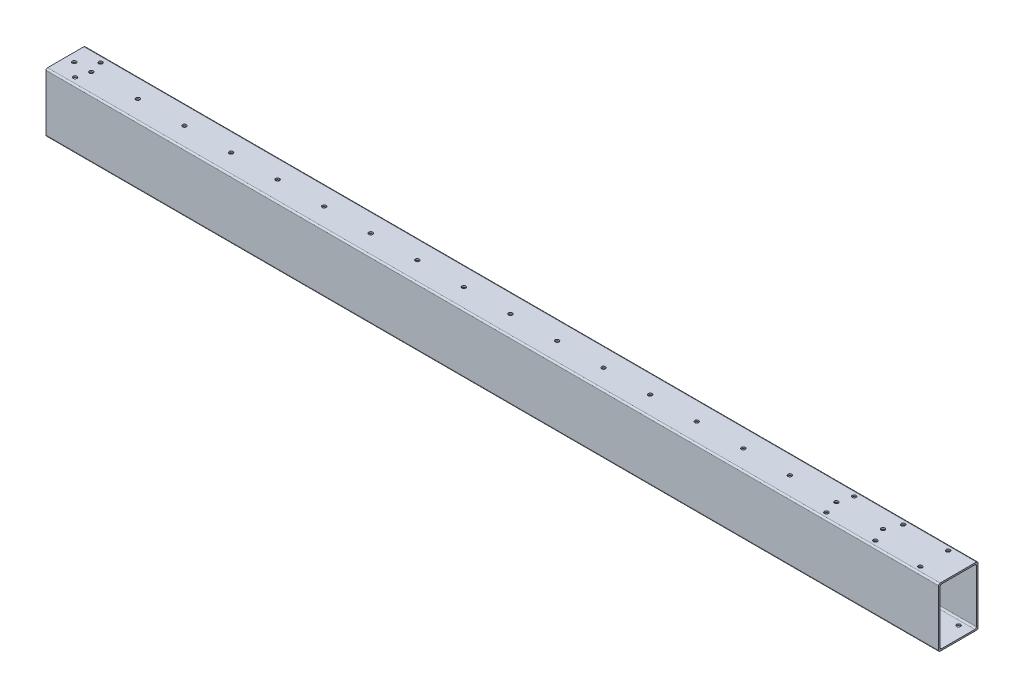
from build123d import *

# Parameters (mm, degrees)
SKETCH1_W             = 50.8
SKETCH1_H             = 76.2
BOSS_EXTRUDE1_DEPTH   = 1150
SKETCH2_W             = 46.8
SKETCH2_H             = 72.2
CUT_EXTRUDE1_DEPTH    = 1151.911278075
FILLET2_R             = 2
CROQUIS1_R            = 2.5
CORTAR_EXTRUIR1_DEPTH = 5
MATRIZL1_COUNT        = 4
MATRIZL1_PITCH        = 357.9333
CROQUIS2_R            = 2.5
CORTAR_EXTRUIR2_DEPTH = 10
CROQUIS3_R            = 2.5
CORTAR_EXTRUIR3_DEPTH = 10
CROQUIS4_R            = 2.5
CORTAR_EXTRUIR4_DEPTH = 10
MATRIZL2_COUNT        = 18
MATRIZL2_PITCH        = 60
CROQUIS5_R            = 2.5
CORTAR_EXTRUIR5_DEPTH = 10


with BuildPart() as part:
    # Sketch1 → Boss-Extrude1 (new body)
    with BuildSketch(Plane(origin=(0, 0, 0), x_dir=(0, 0, -1), z_dir=(1, 0, 0))):
        Rectangle(SKETCH1_W, SKETCH1_H)
    extrude(amount=-BOSS_EXTRUDE1_DEPTH)

    # Sketch2 → Cut-Extrude1 (cut, through all)
    with BuildSketch(Plane(origin=(0, 0, 0), x_dir=(0, 0, -1), z_dir=(1, 0, 0))):
        Rectangle(SKETCH2_W, SKETCH2_H)
    extrude(amount=-CUT_EXTRUDE1_DEPTH, mode=Mode.SUBTRACT)

    # Fillet2
    fillet2_edges = [part.edges().sort_by_distance(p)[0] for p in [
        (-575, -36.1, 23.4),
        (-575, 36.1, 23.4),
        (-575, 36.1, -23.4),
        (-575, -36.1, -23.4),
        (-575, 38.1, 25.4),
        (-575, 38.1, -25.4),
        (-575, -38.1, -25.4),
        (-575, -38.1, 25.4),
    ]]
    fillet(fillet2_edges, radius=FILLET2_R)

    # Croquis1 → Cortar-Extruir1 (cut)
    with BuildSketch(Plane.XZ.offset(38.1)):
        with Locations(Location((-38.1, 0, 0), (0, 0, 270))):
            Circle(CROQUIS1_R)
        with Locations(Location((-61.2, 15.4, 0), (0, 0, 270))):
            Circle(CROQUIS1_R)
        with Locations(Location((-15, 15.4, 0), (0, 0, 270))):
            Circle(CROQUIS1_R)
        with Locations(Location((-15, -15.4, 0), (0, 0, 270))):
            Circle(CROQUIS1_R)
        with Locations(Location((-61.2, -15.4, 0), (0, 0, 270))):
            Circle(CROQUIS1_R)
    cortar_extruir1 = extrude(amount=-CORTAR_EXTRUIR1_DEPTH, mode=Mode.SUBTRACT)

    # MatrizL1: Cortar-Extruir1 ×4
    with Locations(*[(-i * MATRIZL1_PITCH, 0, 0) for i in range(1, MATRIZL1_COUNT)]):
        add(cortar_extruir1, mode=Mode.SUBTRACT)

    # Croquis2 → Cortar-Extruir2 (cut)
    with BuildSketch(Plane(origin=(0, 0, -25.4), x_dir=(-1, 0, 0), z_dir=(0, 0, -1))):
        with Locations(Location((1100, 8.1, 0), (0, 0, 90))):
            Circle(CROQUIS2_R)
        with Locations(Location((225, 8.1, 0), (0, 0, 90))):
            Circle(CROQUIS2_R)
        with Locations(Location((75, -18.1, 0), (0, 0, 90))):
            Circle(CROQUIS2_R)
        with Locations(Location((325, -18.1, 0), (0, 0, 90))):
            Circle(CROQUIS2_R)
        with Locations(Location((675, -18.1, 0), (0, 0, 90))):
            Circle(CROQUIS2_R)
        with Locations(Location((1025, -18.1, 0), (0, 0, 90))):
            Circle(CROQUIS2_R)
    extrude(amount=-CORTAR_EXTRUIR2_DEPTH, mode=Mode.SUBTRACT)

    # Croquis3 → Cortar-Extruir3 (cut)
    with BuildSketch(Plane(origin=(0, 38.1, 0), x_dir=(1, 0, 0), z_dir=(0, 1, 0))):
        with Locations(Location((-31, 17.9, 0), (0, 0, 270))):
            Circle(CROQUIS3_R)
        with Locations(Location((-89, 17.9, 0), (0, 0, 270))):
            Circle(CROQUIS3_R)
        with Locations(Location((-152, 17.9, 0), (0, 0, 270))):
            Circle(CROQUIS3_R)
        with Locations(Location((-152, -17.9, 0), (0, 0, 270))):
            Circle(CROQUIS3_R)
        with Locations(Location((-89, -17.9, 0), (0, 0, 270))):
            Circle(CROQUIS3_R)
        with Locations(Location((-31, -17.9, 0), (0, 0, 270))):
            Circle(CROQUIS3_R)
    extrude(amount=-CORTAR_EXTRUIR3_DEPTH, mode=Mode.SUBTRACT)

    # Croquis4 → Cortar-Extruir4 (cut)
    with BuildSketch(Plane(origin=(0, 38.1, 0), x_dir=(1, 0, 0), z_dir=(0, 1, 0))):
        with Locations(Location((-1117, 0, 0), (0, 0, 270))):
            Circle(CROQUIS4_R)
    cortar_extruir4 = extrude(amount=-CORTAR_EXTRUIR4_DEPTH, mode=Mode.SUBTRACT)

    # MatrizL2: Cortar-Extruir4 ×18
    with Locations(*[(i * MATRIZL2_PITCH, 0, 0) for i in range(1, MATRIZL2_COUNT)]):
        add(cortar_extruir4, mode=Mode.SUBTRACT)

    # Croquis5 → Cortar-Extruir5 (cut)
    with BuildSketch(Plane(origin=(0, 38.1, 0), x_dir=(1, 0, 0), z_dir=(0, 1, 0))):
        with Locations(Location((-1121.5, 16.4, 0), (0, 0, 270))):
            Circle(CROQUIS5_R)
        with Locations(Location((-1121.5, -16.4, 0), (0, 0, 270))):
            Circle(CROQUIS5_R)
        with Locations(Location((-1139, 0, 0), (0, 0, 270))):
            Circle(CROQUIS5_R)
    extrude(amount=-CORTAR_EXTRUIR5_DEPTH, mode=Mode.SUBTRACT)


solid = part.part
